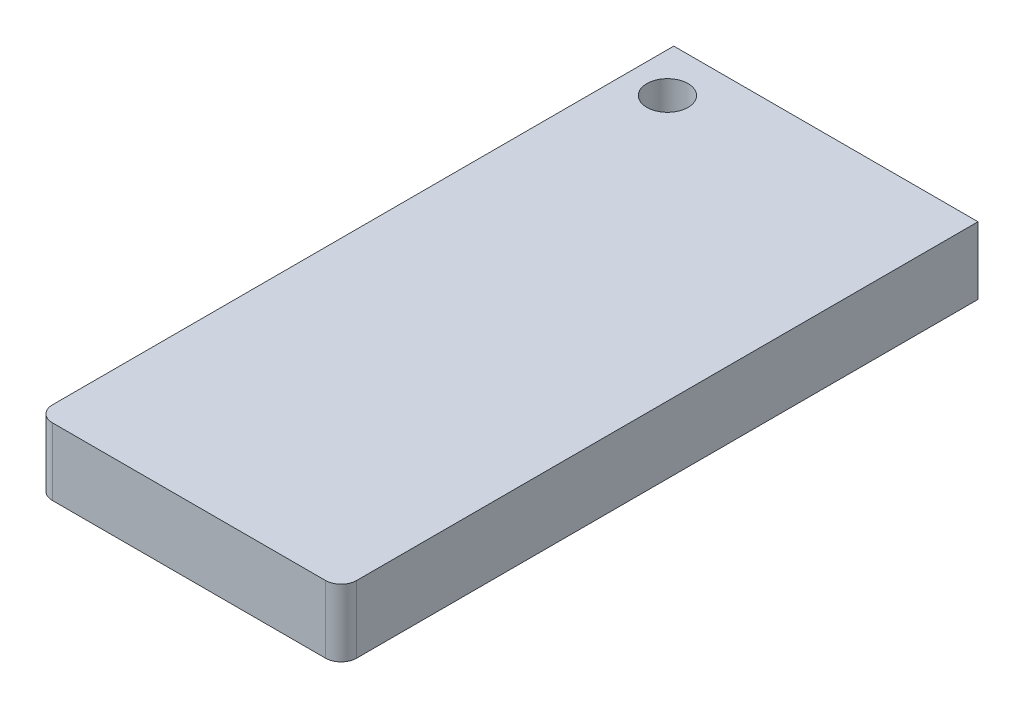
from build123d import *

# Parameters (mm, degrees)
BOSS_EXTRUDE1_DEPTH = 13
SKETCH2_R           = 3.984832534
CUT_EXTRUDE1_DEPTH  = 70.384008424


with BuildPart() as part:
    # Sketch1 → Boss-Extrude1 (new body)
    with BuildSketch(Plane(origin=(0, 0, 0), x_dir=(1, 0, 0), z_dir=(0, 1, 0))):
        with BuildLine():
            Line((-26.375, -61.5), (26.375, -61.5))
            ThreePointArc((26.375, -61.5), (28.496320344, -60.621320344), (29.375, -58.5))
            Line((29.375, -58.5), (29.375, 61.5))
            Line((29.375, 61.5), (-29.375, 61.5))
            Line((-29.375, 61.5), (-29.375, -58.5))
            ThreePointArc((-29.375, -58.5), (-28.496320344, -60.621320344), (-26.375, -61.5))
        make_face()
    extrude(amount=BOSS_EXTRUDE1_DEPTH)

    # Sketch2 → Cut-Extrude1 (cut, through all)
    with BuildSketch(Plane(origin=(0, 13, 0), x_dir=(1, 0, 0), z_dir=(0, 1, 0))):
        with Locations(Location((-21.724826846, 52.625202096, 0), (0, 0, 270))):
            Circle(SKETCH2_R)
    extrude(amount=-CUT_EXTRUDE1_DEPTH, mode=Mode.SUBTRACT)


solid = part.part
